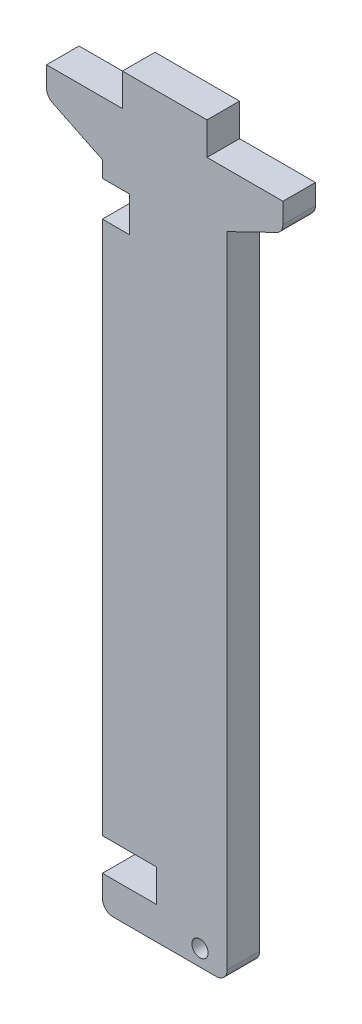
from build123d import *

# Parameters (mm, degrees)
ESQUISSE1_W             = 43.6
ESQUISSE1_H             = 130
BOSS_EXTRU_1_DEPTH      = 6
ENL_V_MAT_EXTRU_1_DEPTH = 6
ESQUISSE4_W             = 15.6
ESQUISSE4_H             = 6
BOSS_EXTRU_2_DEPTH      = 6
ESQUISSE6_W             = 10
ESQUISSE6_H             = 6
ESQUISSE6_W_2           = 5
ESQUISSE6_H_2           = 6.5
ENL_V_MAT_EXTRU_3_DEPTH = 6
CONG_8_R                = 2
CONG_9_R                = 2
ESQUISSE7_R             = 1.5
ENL_V_MAT_EXTRU_4_DEPTH = 6


with BuildPart() as part:
    # Esquisse1 → Boss.-Extru.1 (new body)
    with BuildSketch(Plane.XY):
        with Locations((21.8, 65)):
            Rectangle(ESQUISSE1_W, ESQUISSE1_H)
    extrude(amount=BOSS_EXTRU_1_DEPTH)

    # Esquisse2 → Enlèv. mat.-Extru.1 (cut)
    with BuildSketch(Plane.XY.offset(6)):
        Polygon((43.6, 0), (33.3, 0), (33.3, 120), (43.6, 125), align=None)
        Polygon((10.3, 120), (0, 125), (0, 0), (10.3, 0), align=None)
    extrude(amount=-ENL_V_MAT_EXTRU_1_DEPTH, mode=Mode.SUBTRACT)

    # Esquisse4 → Boss.-Extru.2 (add)
    with BuildSketch(Plane.XY.offset(6)):
        with Locations((21.8, 133)):
            Rectangle(ESQUISSE4_W, ESQUISSE4_H)
    extrude(amount=-BOSS_EXTRU_2_DEPTH)

    # Esquisse6 → Enlèv. mat.-Extru.3 (cut)
    with BuildSketch(Plane.XY.offset(6)):
        with Locations((15.3, 9)):
            Rectangle(ESQUISSE6_W, ESQUISSE6_H)
        with Locations((12.8, 113.75)):
            Rectangle(ESQUISSE6_W_2, ESQUISSE6_H_2)
    extrude(amount=-ENL_V_MAT_EXTRU_3_DEPTH, mode=Mode.SUBTRACT)

    # Congé8
    cong_8_edges = [part.edges().sort_by_distance(p)[0] for p in [
        (33.3, 0, 3),
        (10.3, 0, 3),
    ]]
    fillet(cong_8_edges, radius=CONG_8_R)

    # Congé9
    cong_9_edges = [part.edges().sort_by_distance(p)[0] for p in [
        (43.6, 125, 3),
        (0, 125, 3),
    ]]
    fillet(cong_9_edges, radius=CONG_9_R)

    # Esquisse7 → Enlèv. mat.-Extru.4 (cut)
    with BuildSketch(Plane.XY.offset(6)):
        with Locations((28.3, 3)):
            Circle(ESQUISSE7_R)
    extrude(amount=-ENL_V_MAT_EXTRU_4_DEPTH, mode=Mode.SUBTRACT)


solid = part.part
